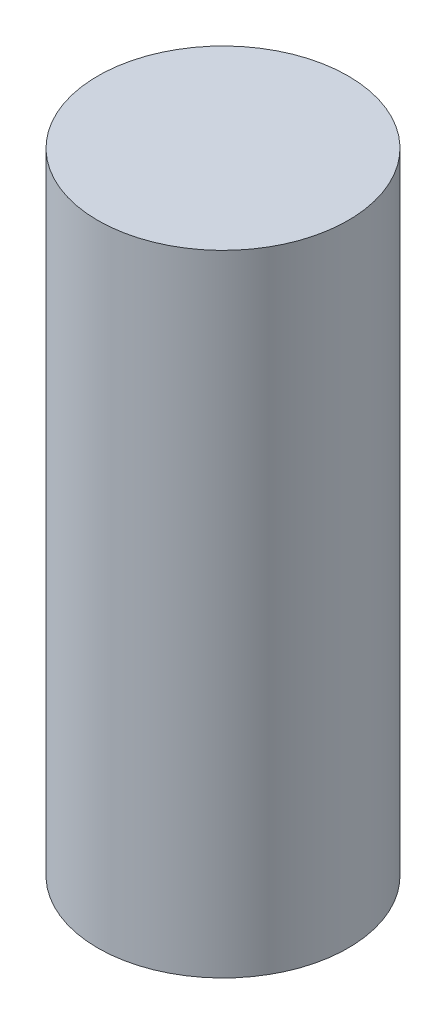
from build123d import *

# Parameters (mm, degrees)
SZKIC1_R                    = 2.225
DODANIE_WYCI_GNI_CIE1_DEPTH = 5.6


with BuildPart() as part:
    # Szkic1 → Dodanie-wyciągnięcie1 (new, symmetric)
    with BuildSketch(Plane(origin=(0, 0, 0), x_dir=(1, 0, 0), z_dir=(0, 1, 0))):
        with Locations(Location((0, 0, 0), (0, 0, 270))):
            Circle(SZKIC1_R)
    extrude(amount=DODANIE_WYCI_GNI_CIE1_DEPTH, both=True)


solid = part.part
